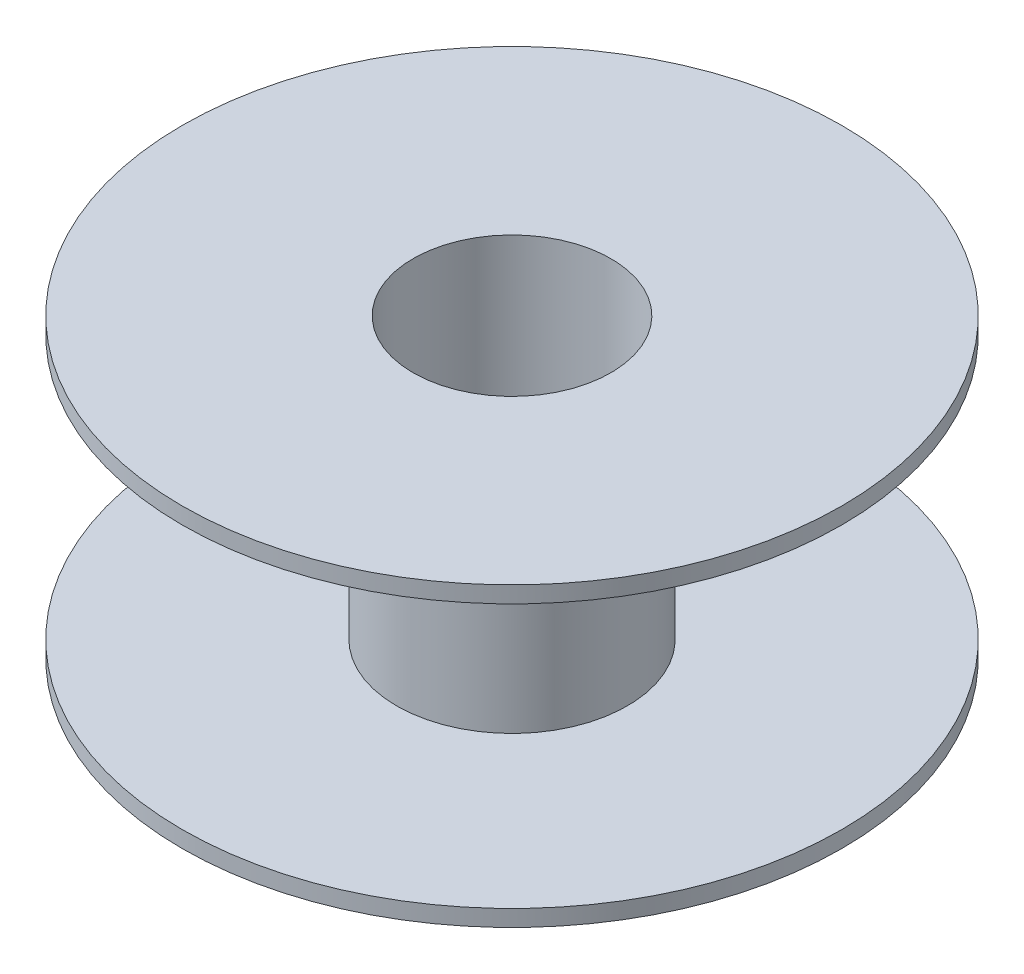
from build123d import *

# Parameters (mm, degrees)
SKETCH1_R           = 100
SKETCH1_R_2         = 30
BOSS_EXTRUDE1_DEPTH = 5
SKETCH2_R           = 35
SKETCH2_R_2         = 30
BOSS_EXTRUDE2_DEPTH = 40


with BuildPart() as part:
    # Sketch1 → Boss-Extrude1 (new body)
    with BuildSketch(Plane(origin=(0, 0, 0), x_dir=(1, 0, 0), z_dir=(0, 1, 0))):
        with Locations(Location((0, 0, 0), (0, 0, 270))):
            Circle(SKETCH1_R)
        with Locations(Location((0, 0, 0), (0, 0, 270))):
            Circle(SKETCH1_R_2, mode=Mode.SUBTRACT)
    boss_extrude1 = extrude(amount=BOSS_EXTRUDE1_DEPTH)

    # Sketch2 → Boss-Extrude2 (add)
    with BuildSketch(Plane(origin=(0, 5, 0), x_dir=(1, 0, 0), z_dir=(0, 1, 0))):
        with Locations(Location((0, 0, 0), (0, 0, 270))):
            Circle(SKETCH2_R)
        with Locations(Location((0, 0, 0), (0, 0, 270))):
            Circle(SKETCH2_R_2, mode=Mode.SUBTRACT)
    boss_extrude2 = extrude(amount=BOSS_EXTRUDE2_DEPTH)

    # Mirror1: Boss-Extrude1, Boss-Extrude2 across plane
    add(boss_extrude1.mirror(Plane.ZX.offset(45)))
    add(boss_extrude2.mirror(Plane.ZX.offset(45)))


solid = part.part
